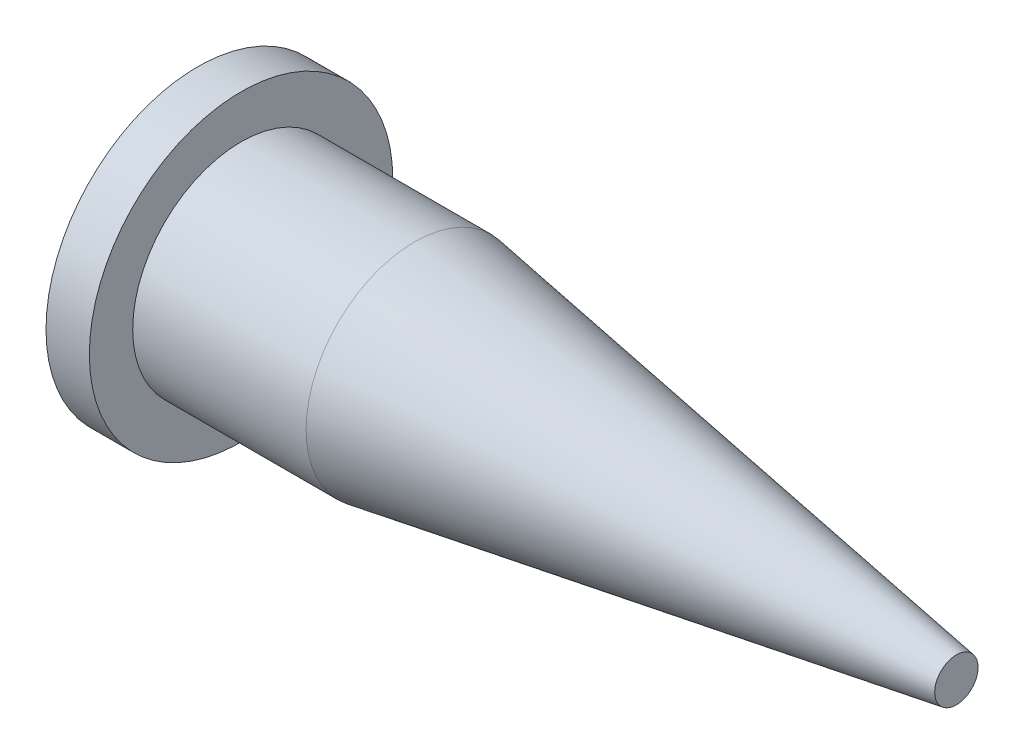
from build123d import *


with BuildPart() as part:
    # Schizzo1 → Rivoluzione1 (revolve)
    with BuildSketch(Plane(origin=(0, 0, 0), x_dir=(1, 0, 0), z_dir=(0, 1, 0)), mode=Mode.PRIVATE) as rivoluzione1_sk:
        Polygon((-8.878504673, 4.813084112), (-8.878504673, 2.813084112), (-0.878504673, 2.813084112), (24.121495327, -1.186915888), (24.121495327, -2.186915888), (-10.878504673, -2.186915888), (-10.878504673, 4.813084112), align=None)
    revolve(rivoluzione1_sk.sketch.rotate(Axis((-10.878504673, 0, 2.186915888), (1, 0, 0)), 180), axis=Axis((-10.878504673, 0, 2.186915888), (1, 0, 0)))


solid = part.part
